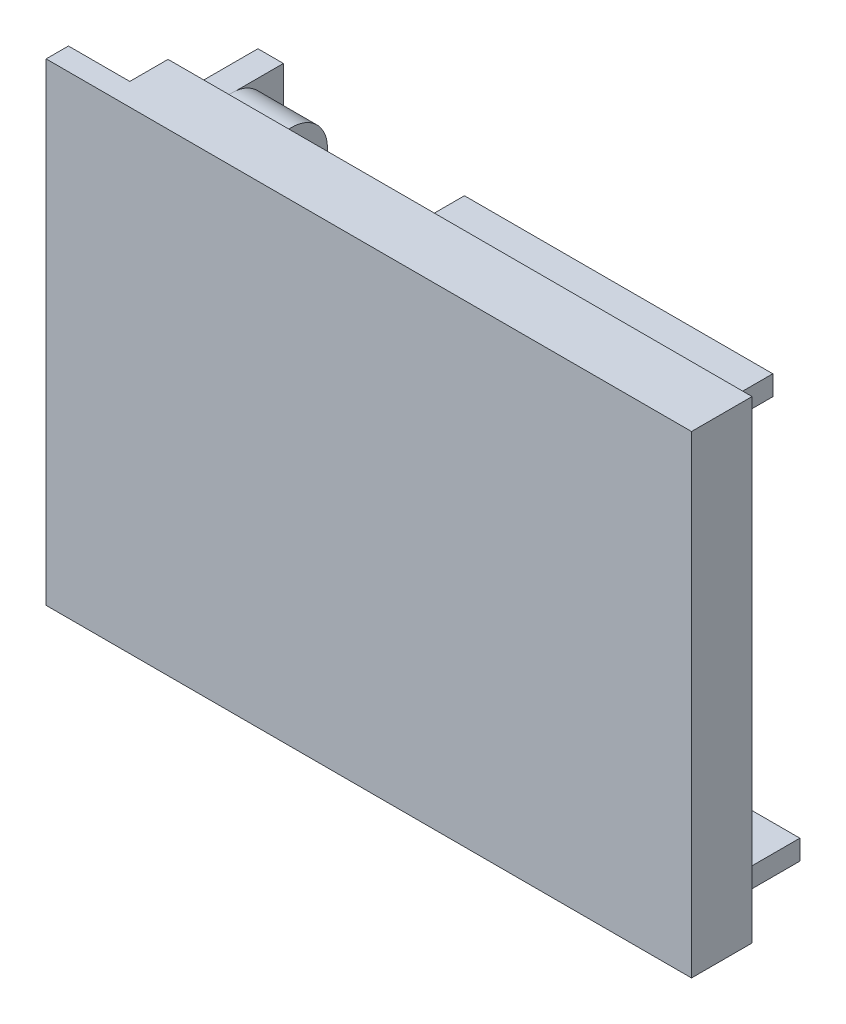
from build123d import *

# Parameters (mm, degrees)
SKETCH1_W               = 81
SKETCH1_H               = 59.4
CARRIER_BASE_DEPTH      = 7.6
SKETCH2_W               = 7.7
SKETCH2_H               = 59.4
CUT_EXTRUDE1_DEPTH      = 4.8
SKETCH3_W               = 38.7
SKETCH3_H               = 2.5
ANALOG_POWER_BANK_DEPTH = 8.3
SKETCH4_W               = 37.2
SKETCH4_H               = 2.5
DIGITAL_BANK_DEPTH      = 8.3
SKETCH5_W               = 3.2
SKETCH5_H               = 8.8
F_5V_INPUT_DEPTH        = 11.3
SKETCH7_R               = 4.5
BOSS_EXTRUDE6_DEPTH     = 7.5
SKETCH8_R               = 3.019250474
CUT_EXTRUDE2_DEPTH      = 5
SKETCH9_W               = 6.4
SKETCH9_H               = 8.9
USB_C_DEPTH             = 3.4
FILLET3_R               = 0.5
CUT_EXTRUDE3_DEPTH      = 5.8
SKETCH11_W              = 6.5
SKETCH11_H              = 6.5
BOSS_EXTRUDE12_DEPTH    = 1.75
SKETCH12_R              = 1.697531851
RESET_DEPTH             = 1.75


with BuildPart() as part:
    # Sketch1 → Carrier / Base (new body)
    with BuildSketch(Plane.XY):
        Rectangle(SKETCH1_W, SKETCH1_H)
    extrude(amount=CARRIER_BASE_DEPTH)

    # Sketch2 → Cut-Extrude1 (cut)
    with BuildSketch(Plane(origin=(0, 0, 0), x_dir=(-1, 0, 0), z_dir=(0, 0, -1))):
        with Locations((36.65, 0)):
            Rectangle(SKETCH2_W, SKETCH2_H)
    extrude(amount=-CUT_EXTRUDE1_DEPTH, mode=Mode.SUBTRACT)

    # Sketch3 → Analog / Power Bank (add)
    with BuildSketch(Plane(origin=(0, 0, 0), x_dir=(-1, 0, 0), z_dir=(0, 0, -1))):
        with Locations((-15.45, 23.926979164)):
            Rectangle(SKETCH3_W, SKETCH3_H)
    extrude(amount=ANALOG_POWER_BANK_DEPTH)

    # Sketch4 → Digital Bank (add)
    with BuildSketch(Plane(origin=(0, 0, 0), x_dir=(-1, 0, 0), z_dir=(0, 0, -1))):
        with Locations((-19.6, -24.85)):
            Rectangle(SKETCH4_W, SKETCH4_H)
    extrude(amount=DIGITAL_BANK_DEPTH)

    # Sketch5 → 5V Input (add)
    with BuildSketch(Plane(origin=(0, 0, 0), x_dir=(-1, 0, 0), z_dir=(0, 0, -1))):
        with Locations((31.21956927, 20.79458393)):
            Rectangle(SKETCH5_W, SKETCH5_H)
    extrude(amount=F_5V_INPUT_DEPTH)

    # Sketch7 → Boss-Extrude6 (add)
    with BuildSketch(Plane(origin=(-29.61956927, 0, 0), x_dir=(0, 0, -1), z_dir=(1, 0, 0))):
        with Locations(Location((4.827826856, 20.730910649, 0), (0, 0, 254.499508307))):
            Circle(SKETCH7_R)
    extrude(amount=BOSS_EXTRUDE6_DEPTH)

    # Sketch8 → Cut-Extrude2 (cut)
    with BuildSketch(Plane.ZY.offset(32.81956927)):
        with Locations((-5.241560024, 20.985277651)):
            Circle(SKETCH8_R)
    extrude(amount=-CUT_EXTRUDE2_DEPTH, mode=Mode.SUBTRACT)

    # Sketch9 → USB-C (add)
    with BuildSketch(Plane(origin=(0, 0, 0), x_dir=(-1, 0, 0), z_dir=(0, 0, -1))):
        with Locations((29.6, -13.15)):
            Rectangle(SKETCH9_W, SKETCH9_H)
    extrude(amount=USB_C_DEPTH)

    # Fillet3
    fillet3_edges = [part.edges().sort_by_distance(p)[0] for p in [
        (-32.8, -13.15, -3.4),
        (-29.6, -8.7, -3.4),
        (-26.4, -13.15, -3.4),
        (-29.6, -17.6, -3.4),
    ]]
    fillet(fillet3_edges, radius=FILLET3_R)

    # Sketch10 → Cut-Extrude3 (cut)
    with BuildSketch(Plane.ZY.offset(32.8)):
        with BuildLine():
            Line((-1.928214934, -16.631364992), (-1.928214934, -9.789588696))
            ThreePointArc((-1.928214934, -9.789588696), (-1.229070102, -9.090443863), (-0.52992527, -9.789588696))
            Line((-0.52992527, -9.789588696), (-0.52992527, -16.631364992))
            ThreePointArc((-0.52992527, -16.631364992), (-1.229070102, -17.330509824), (-1.928214934, -16.631364992))
        make_face()
    extrude(amount=-CUT_EXTRUDE3_DEPTH, mode=Mode.SUBTRACT)

    # Sketch11 → Boss-Extrude12 (add)
    with BuildSketch(Plane(origin=(0, 0, 0), x_dir=(-1, 0, 0), z_dir=(0, 0, -1))):
        with Locations((27.822665658, -24.892209285)):
            Rectangle(SKETCH11_W, SKETCH11_H)
    extrude(amount=BOSS_EXTRUDE12_DEPTH)

    # Sketch12 → Reset (add)
    with BuildSketch(Plane(origin=(0, 0, -1.75), x_dir=(-1, 0, 0), z_dir=(0, 0, -1))):
        with Locations(Location((27.87525987, -25.172094467, 0), (0, 0, 180))):
            Circle(SKETCH12_R)
    extrude(amount=RESET_DEPTH)


solid = part.part
